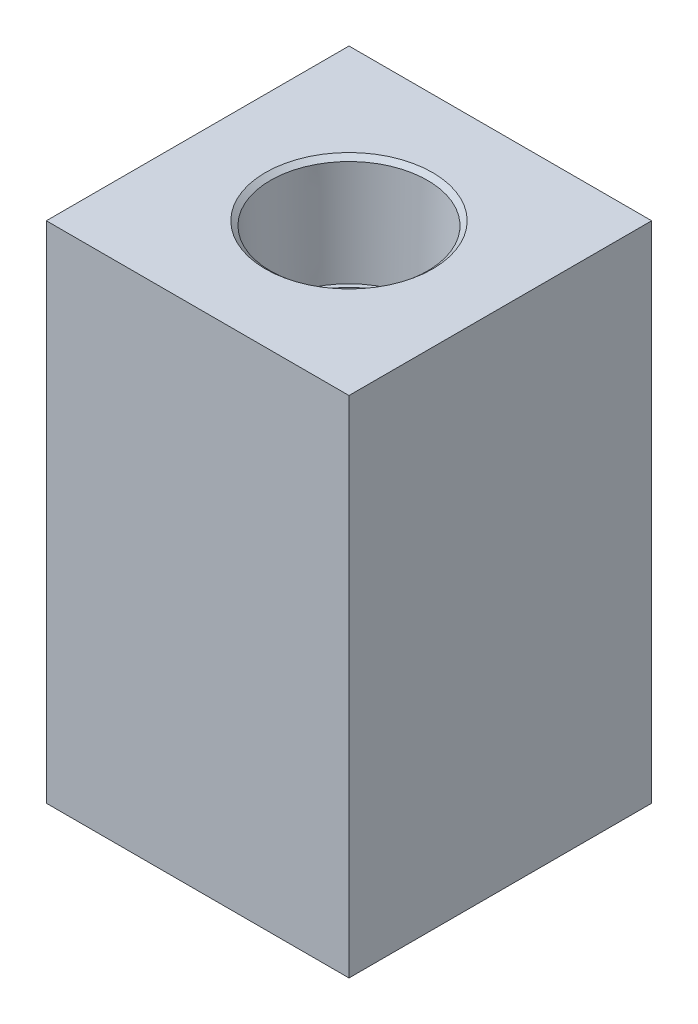
from build123d import *

# Parameters (mm, degrees)
SKETCH_1_W         = 38.1
SKETCH_1_H         = 38.1
EXTRUDE_1_DEPTH    = 63.5
SKETCH5_R          = 5.588
CUT_EXTRUDE1_DEPTH = 69.978656119


with BuildPart() as part:
    # 草图1 → 凸台-拉伸1 (new body)
    with BuildSketch(Plane(origin=(0, 0, 0), x_dir=(1, 0, 0), z_dir=(0, 1, 0))):
        Rectangle(SKETCH_1_W, SKETCH_1_H)
    extrude(amount=EXTRUDE_1_DEPTH)

    # Sketch2 → 1/2 NPT Tapped Hole2 (revolve, cut)
    with BuildSketch(Plane(origin=(0, 63.5, 0), x_dir=(0, 0, 1), z_dir=(1, 0, 0))):
        Polygon((0, 0), (0, 28.004543693), (8.9281, 22.64), (8.9281, 13.57), (9.479012286, 13.57), (9.8860229, 0.532828266), (10.5210229, 0), align=None)
    revolve(axis=Axis((0, 69.85, 0), (0, -1, 0)), mode=Mode.SUBTRACT)

    # Sketch4 → 1/2 NPT Tapped Hole1 (revolve, cut)
    with BuildSketch(Plane(origin=(0.428891136, 0, -0.986449612), x_dir=(0, 0, -1), z_dir=(1, 0, 0))):
        Polygon((0, 0), (0, 28.004543693), (8.9281, 22.64), (8.9281, 13.57), (9.479012286, 13.57), (9.8860229, 0.532828266), (10.5210229, 0), align=None)
    revolve(axis=Axis((0.428891136, -6.35, -0.986449612), (0, 1, 0)), mode=Mode.SUBTRACT)

    # Sketch5 → Cut-Extrude1 (cut, through all)
    with BuildSketch(Plane(origin=(0, 63.5, 0), x_dir=(1, 0, 0), z_dir=(0, 1, 0))):
        Circle(SKETCH5_R)
    extrude(amount=-CUT_EXTRUDE1_DEPTH, mode=Mode.SUBTRACT)


solid = part.part
